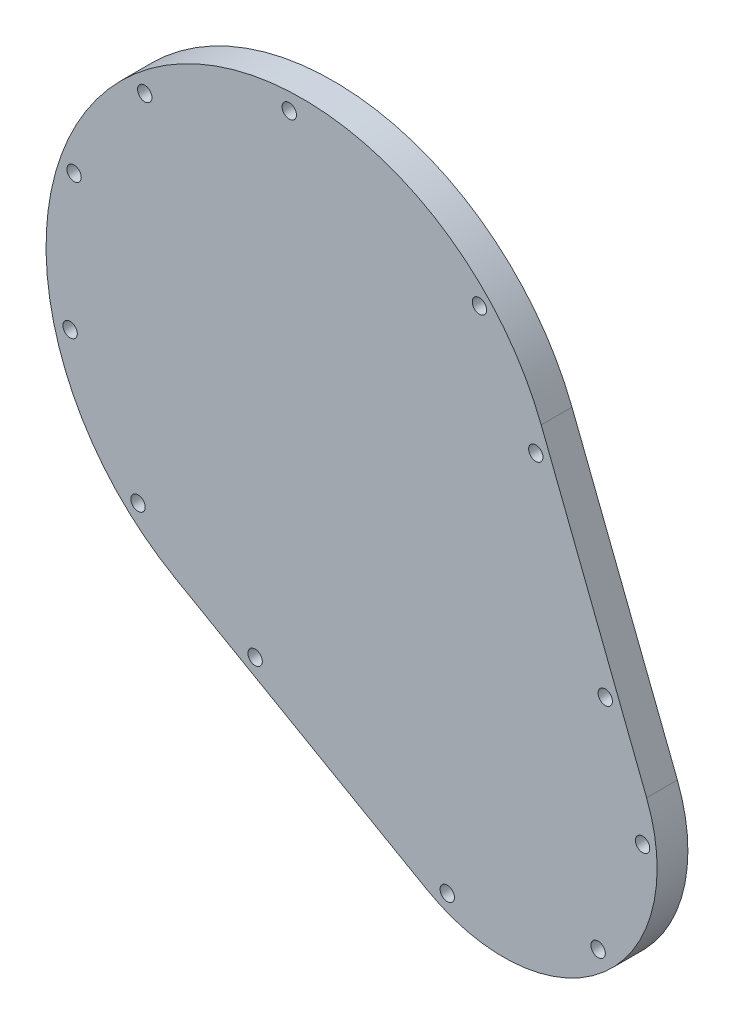
from build123d import *

# Parameters (mm, degrees)
BOSS_EXTRUDE1_DEPTH        = 3.81
F_50_0_07_DIAMETER_HOLE3_D = 1.778


with BuildPart() as part:
    # Sketch1 → Boss-Extrude1 (new body)
    with BuildSketch(Plane.XY):
        with BuildLine():
            Line((0, 0), (31.187102024, -17.823710818))
            ThreePointArc((31.187102024, -17.823710818), (53.082286429, -15.709260563), (58.387158413, 5.638534012))
            Line((58.387158413, 5.638534012), (45.333427314, 39.103741383))
            ThreePointArc((45.333427314, 39.103741383), (-4.983807045, 51.60744456), (0, 0))
        make_face()
    extrude(amount=BOSS_EXTRUDE1_DEPTH)

    # #50 (0.07) Diameter Hole3 (through all)
    with Locations(Plane.XY.offset(3.81)):
        with Locations((-3.770169746, 50.098384989), (14.127303317, 57.178704003), (37.679197815, 48.033291943), (57.887608334, 0.388645245), (52.380693545, -13.624486137), (33.69651837, -16.967970116), (9.898779461, -3.544865319), (-4.606040741, 5.748053387), (-13.01391957, 20.154535826), (-12.52223075, 37.166969012), (44.661179065, 35.741071433), (53.265733422, 13.860918924)):
            Hole(F_50_0_07_DIAMETER_HOLE3_D / 2)


solid = part.part
